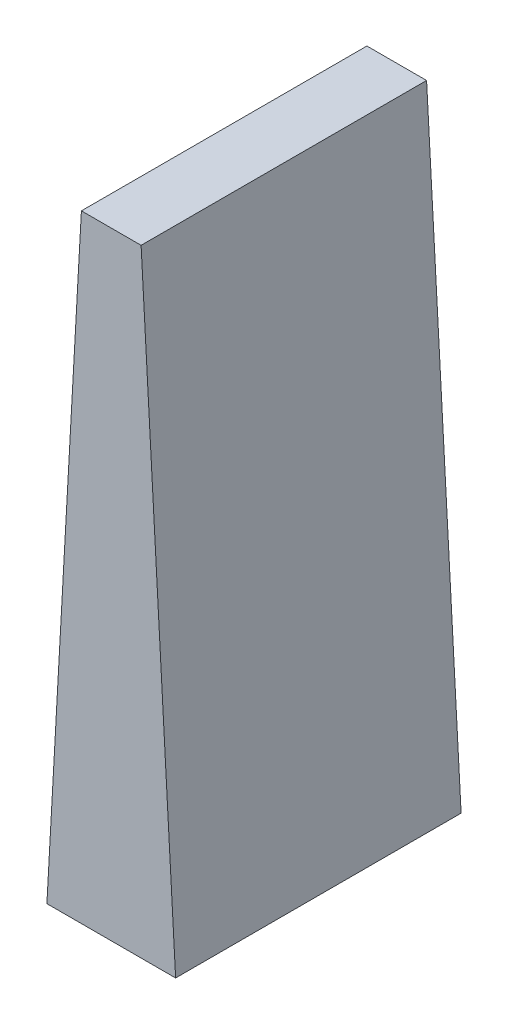
from build123d import *

# Parameters (mm, degrees)
BOSS_EXTRUDE1_DEPTH = 8.9281


with BuildPart() as part:
    # Sketch1 → Boss-Extrude1 (new body)
    with BuildSketch(Plane.XY):
        Polygon((-0.93345, 9.652), (-2.01295, -9.652), (2.01295, -9.652), (0.93345, 9.652), align=None)
    extrude(amount=BOSS_EXTRUDE1_DEPTH)


solid = part.part
